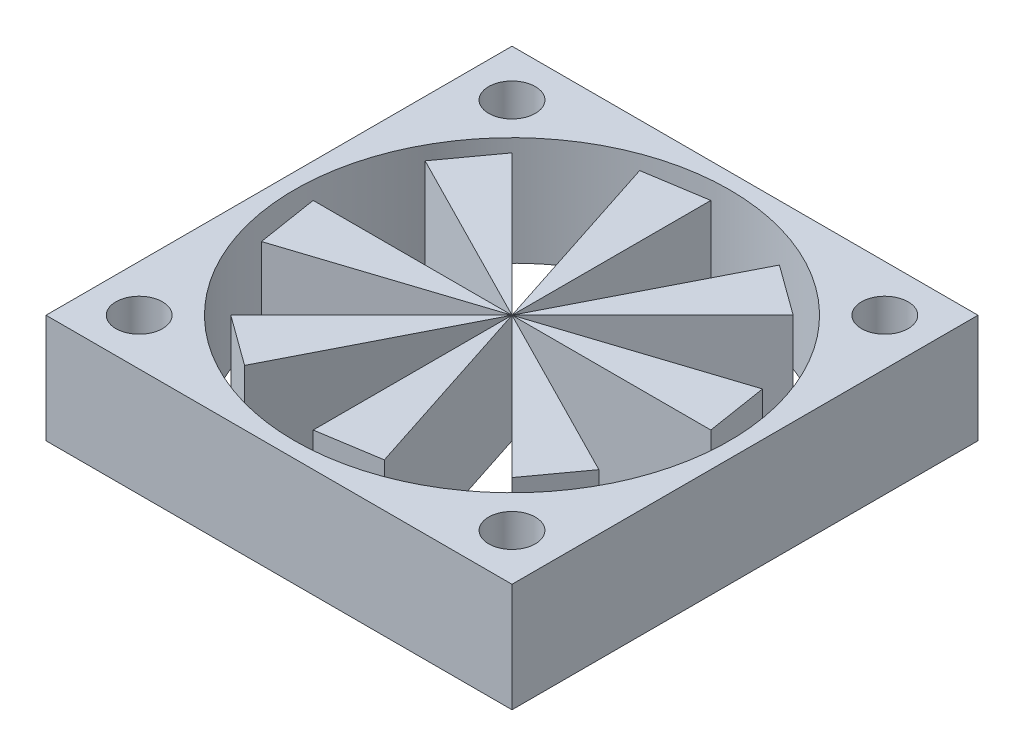
from build123d import *

# Parameters (mm, degrees)
SKETCH_1_W        = 30
SKETCH_1_H        = 30
SKETCH_1_R        = 1.5
SKETCH_1_R_2      = 14
EXTRUDE_1_DEPTH   = 7
EXTRUDE_2_DEPTH   = 7
EXTRUDE_2_2_DEPTH = 7
EXTRUDE_2_3_DEPTH = 7
EXTRUDE_2_4_DEPTH = 7
EXTRUDE_2_5_DEPTH = 7
EXTRUDE_2_6_DEPTH = 7
EXTRUDE_2_7_DEPTH = 7
EXTRUDE_2_8_DEPTH = 7


with BuildPart() as part:
    # 草图1 → 凸台-拉伸1 (new body)
    with BuildSketch(Plane(origin=(0, 0, 0), x_dir=(1, 0, 0), z_dir=(0, 1, 0))):
        with Locations((1.16, 0.76)):
            Rectangle(SKETCH_1_W, SKETCH_1_H)
        with Locations(Location((-10.84, 12.76, 0), (0, 0, 270))):
            Circle(SKETCH_1_R, mode=Mode.SUBTRACT)
        with Locations(Location((-10.84, -11.24, 0), (0, 0, 270))):
            Circle(SKETCH_1_R, mode=Mode.SUBTRACT)
        with Locations(Location((13.16, -11.24, 0), (0, 0, 270))):
            Circle(SKETCH_1_R, mode=Mode.SUBTRACT)
        with Locations(Location((13.16, 12.76, 0), (0, 0, 270))):
            Circle(SKETCH_1_R, mode=Mode.SUBTRACT)
        with Locations(Location((1.16, 0.76, 0), (0, 0, 270))):
            Circle(SKETCH_1_R_2, mode=Mode.SUBTRACT)
    extrude(amount=EXTRUDE_1_DEPTH)


with BuildPart() as body_2:
    # 草图2 → 凸台-拉伸2 (new body)
    with BuildSketch(Plane.XZ):
        Polygon((1.16, -0.76), (10.210966799, -9.810966799), (6.971078397, -12.16488351), align=None)
    extrude(amount=-EXTRUDE_2_DEPTH)


with BuildPart() as body_3:
    # 草图2 → Extrude 2 2 (new body)
    with BuildSketch(Plane.XZ):
        Polygon((-2.795417528, -12.933523409), (1.16, -0.76), (1.16, -13.56), align=None)
    extrude(amount=-EXTRUDE_2_2_DEPTH)


with BuildPart() as body_4:
    # 草图2 → Extrude 2 3 (new body)
    with BuildSketch(Plane.XZ):
        Polygon((1.16, -0.76), (-7.890966799, -9.810966799), (-10.24488351, -6.571078397), align=None)
    extrude(amount=-EXTRUDE_2_3_DEPTH)


with BuildPart() as body_5:
    # 草图2 → Extrude 2 4 (new body)
    with BuildSketch(Plane.XZ):
        Polygon((1.16, -0.76), (-11.64, -0.76), (-11.013523409, 3.195417528), align=None)
    extrude(amount=-EXTRUDE_2_4_DEPTH)


with BuildPart() as body_6:
    # 草图2 → Extrude 2 5 (new body)
    with BuildSketch(Plane.XZ):
        Polygon((1.16, -0.76), (-7.890966799, 8.290966799), (-4.651078397, 10.64488351), align=None)
    extrude(amount=-EXTRUDE_2_5_DEPTH)


with BuildPart() as body_7:
    # 草图2 → Extrude 2 6 (new body)
    with BuildSketch(Plane.XZ):
        Polygon((1.16, -0.76), (1.16, 12.04), (5.115417528, 11.413523409), align=None)
    extrude(amount=-EXTRUDE_2_6_DEPTH)


with BuildPart() as body_8:
    # 草图2 → Extrude 2 7 (new body)
    with BuildSketch(Plane.XZ):
        Polygon((1.16, -0.76), (10.210966799, 8.290966799), (12.56488351, 5.051078397), align=None)
    extrude(amount=-EXTRUDE_2_7_DEPTH)


with BuildPart() as body_9:
    # 草图2 → Extrude 2 8 (new body)
    with BuildSketch(Plane.XZ):
        Polygon((1.16, -0.76), (13.96, -0.76), (13.333523409, -4.715417528), align=None)
    extrude(amount=-EXTRUDE_2_8_DEPTH)


solid = Compound([part.part, body_2.part, body_3.part, body_4.part, body_5.part, body_6.part, body_7.part, body_8.part, body_9.part])
